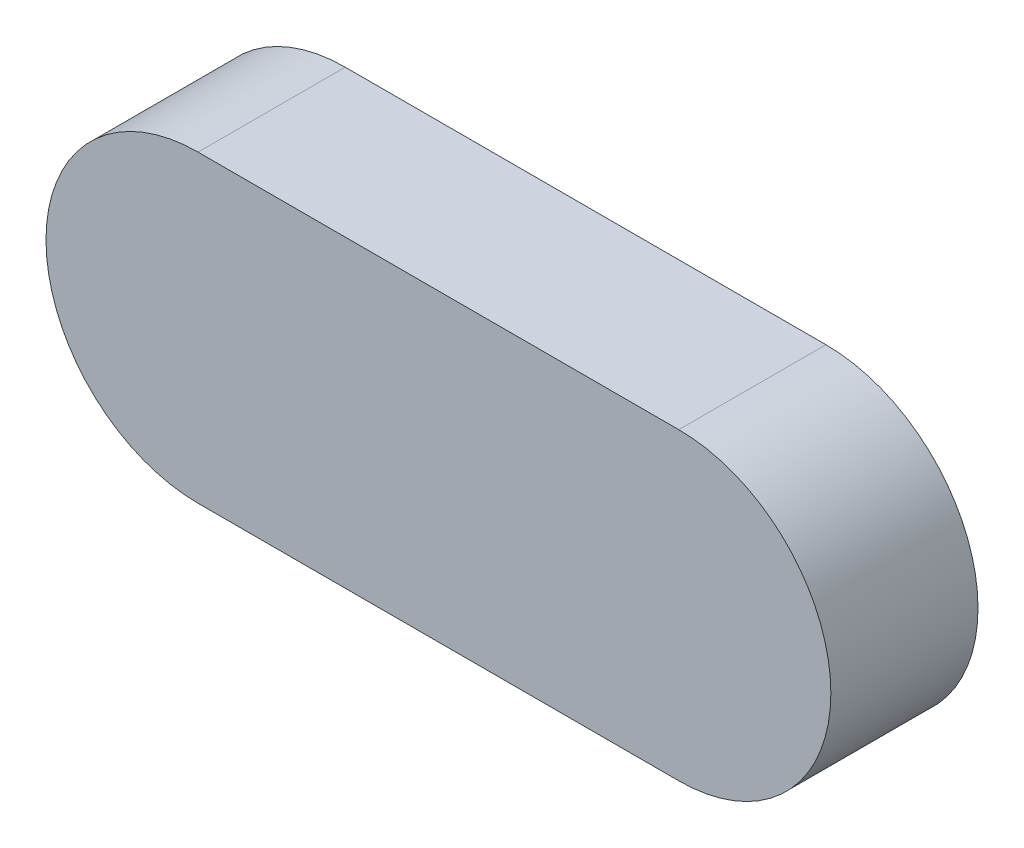
from build123d import *

# Parameters (mm, degrees)
BOSS_EXTRUDE1_DEPTH = 7.5


with BuildPart() as part:
    # Sketch1 → Boss-Extrude1 (new body)
    with BuildSketch(Plane.XY):
        with BuildLine():
            Line((0, 7.75), (24.5, 7.75))
            ThreePointArc((24.5, 7.75), (32.25, 0), (24.5, -7.75))
            Line((24.5, -7.75), (0, -7.75))
            ThreePointArc((0, -7.75), (-7.75, 0), (0, 7.75))
        make_face()
    extrude(amount=BOSS_EXTRUDE1_DEPTH)


solid = part.part
